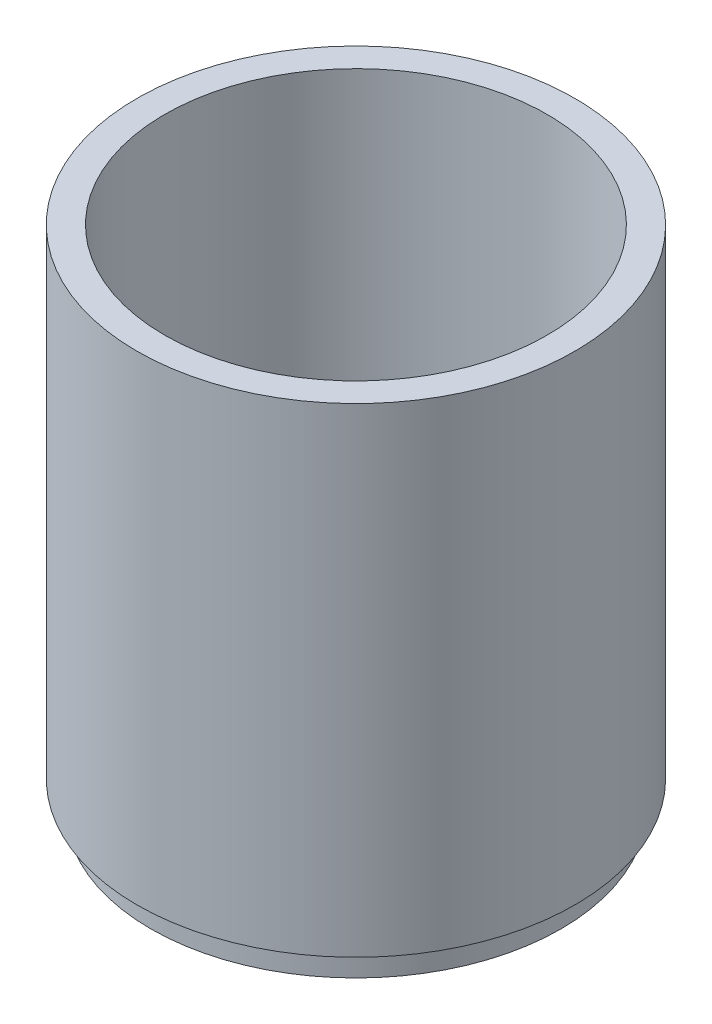
from build123d import *

# Parameters (mm, degrees)
SKETCH1_R           = 7.4
SKETCH1_R_2         = 6.4
BOSS_EXTRUDE1_DEPTH = 1
SKETCH2_R           = 7.9
SKETCH2_R_2         = 6.9
BOSS_EXTRUDE2_DEPTH = 17.3


with BuildPart() as part:
    # Sketch1 → Boss-Extrude1 (new body)
    with BuildSketch(Plane(origin=(0, 0, 0), x_dir=(1, 0, 0), z_dir=(0, 1, 0))):
        with Locations(Location((0, 0, 0), (0, 0, 270))):
            Circle(SKETCH1_R)
        with Locations(Location((0, 0, 0), (0, 0, 270))):
            Circle(SKETCH1_R_2, mode=Mode.SUBTRACT)
    extrude(amount=BOSS_EXTRUDE1_DEPTH)

    # Sketch2 → Boss-Extrude2 (add)
    with BuildSketch(Plane(origin=(0, 1, 0), x_dir=(1, 0, 0), z_dir=(0, 1, 0))):
        with Locations(Location((0, 0, 0), (0, 0, 270))):
            Circle(SKETCH2_R)
        with Locations(Location((0, 0, 0), (0, 0, 270))):
            Circle(SKETCH2_R_2, mode=Mode.SUBTRACT)
    extrude(amount=BOSS_EXTRUDE2_DEPTH)


solid = part.part
